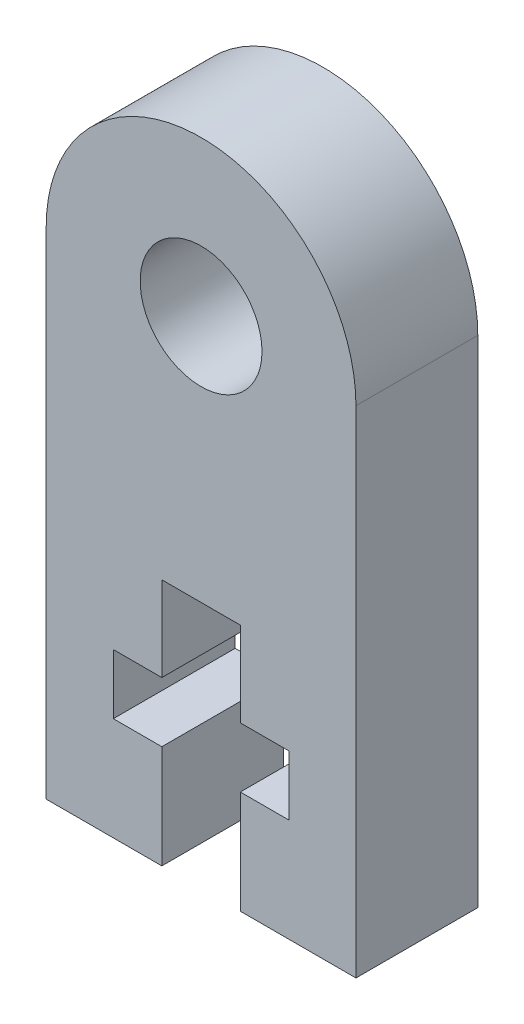
from build123d import *

# Parameters (mm, degrees)
SKETCH1_R           = 2.95
BOSS_EXTRUDE1_DEPTH = 5.9
CUT_EXTRUDE2_DEPTH  = 26.827504719


with BuildPart() as part:
    # Sketch1 → Boss-Extrude1 (new body)
    with BuildSketch(Plane.XY):
        with BuildLine():
            Line((-7.5, 0), (-7.5, -24))
            Line((-7.5, -24), (7.5, -24))
            Line((7.5, -24), (7.5, 0))
            ThreePointArc((7.5, 0), (0, 7.5), (-7.5, 0))
        make_face()
        Circle(SKETCH1_R, mode=Mode.SUBTRACT)
    extrude(amount=BOSS_EXTRUDE1_DEPTH)

    # Sketch3 → Cut-Extrude2 (cut, through all)
    with BuildSketch(Plane.XY.offset(5.9)):
        Polygon((-1.9, -24), (1.9, -24), (1.9, -19), (4.25, -19), (4.25, -16.1), (1.9, -16.1), (1.9, -12), (-1.9, -12), (-1.9, -16.1), (-4.25, -16.1), (-4.25, -19), (-1.9, -19), align=None)
    extrude(amount=-CUT_EXTRUDE2_DEPTH, mode=Mode.SUBTRACT)


solid = part.part
